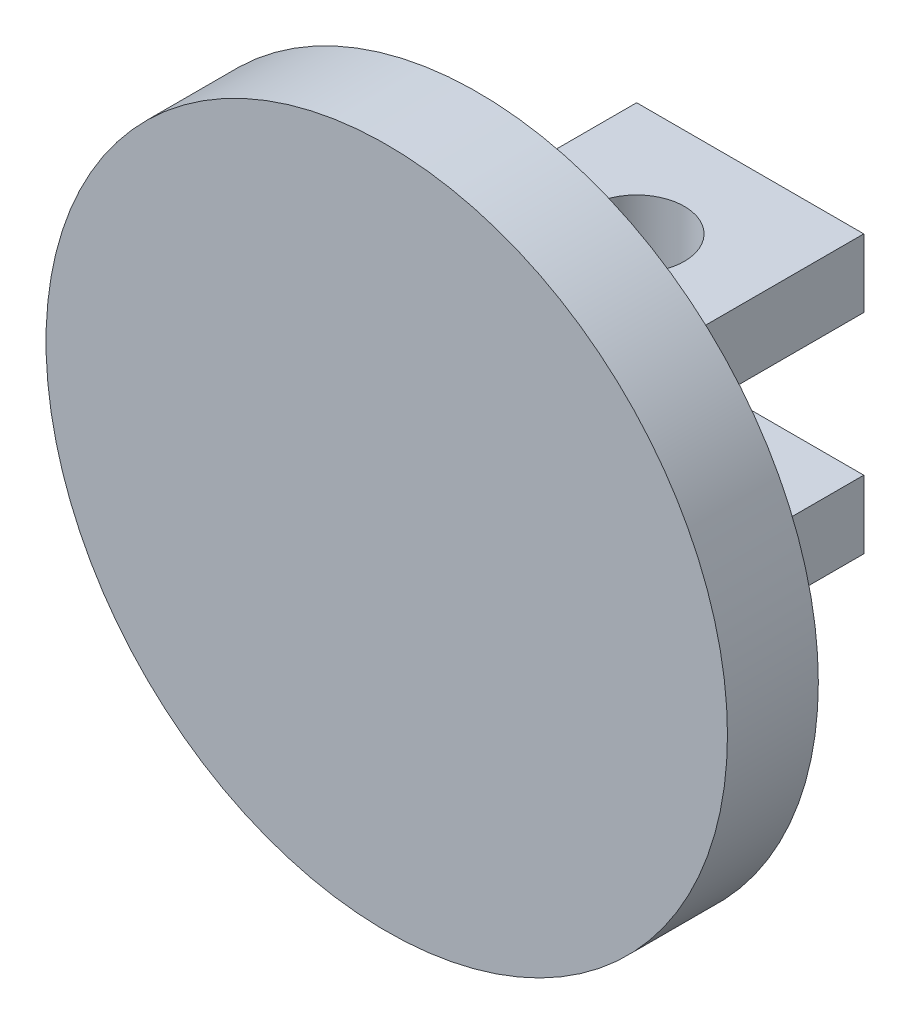
from build123d import *

# Parameters (mm, degrees)
SKETCH_1_R          = 15
EXTRUDE_1_DEPTH     = 4
SKETCH_2_W          = 10
SKETCH_2_H          = 3
EXTRUDE_2_DEPTH     = 12
SKETCH_3_R          = 2.1
CUT_EXTRUDE_1_DEPTH = 16


with BuildPart() as part:
    # 草图1 → 凸台-拉伸1 (new body)
    with BuildSketch(Plane.XY):
        Circle(SKETCH_1_R)
    extrude(amount=EXTRUDE_1_DEPTH)

    # 草图2 → 凸台-拉伸2 (add)
    with BuildSketch(Plane.XY):
        with Locations((0, -4.6)):
            Rectangle(SKETCH_2_W, SKETCH_2_H)
        with Locations((0, 4.6)):
            Rectangle(SKETCH_2_W, SKETCH_2_H)
    extrude(amount=-EXTRUDE_2_DEPTH)

    # 草图3 → 切除-拉伸1 (cut)
    with BuildSketch(Plane(origin=(0, 6.1, 0), x_dir=(1, 0, 0), z_dir=(0, 1, 0))):
        with Locations(Location((0, 7, 0), (0, 0, 270))):
            Circle(SKETCH_3_R)
    extrude(amount=-CUT_EXTRUDE_1_DEPTH, mode=Mode.SUBTRACT)


solid = part.part
